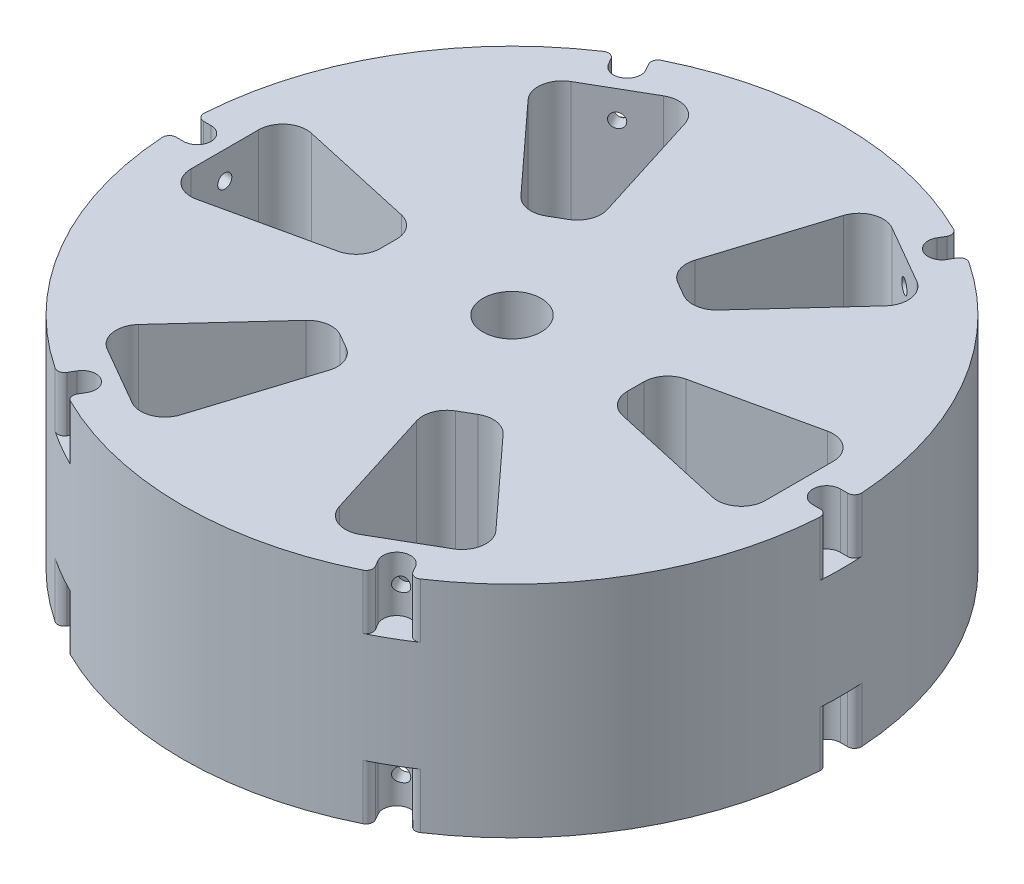
from build123d import *

# Parameters (mm, degrees)
SKETCH1_R                        = 76.2
SKETCH1_R_2                      = 15.875
BOSS_EXTRUDE1_DEPTH              = 25.4
CUT_EXTRUDE1_START               = -12.7
CUT_EXTRUDE1_DEPTH               = 12.7
CUT_EXTRUDE2_DEPTH               = 120.1365603
F_30_0_1285_DIAMETER_HOLE1_D     = 3.2639
F_30_0_1285_DIAMETER_HOLE1_DEPTH = 9.779
FILLET1_R                        = 1.5875
FILLET2_R                        = 5.55625
CIRPATTERN1_COUNT                = 6
CIRPATTERN1_START                = -12.7
CIRPATTERN1_COPY_1_DEPTH         = 12.7
CIRPATTERN1_COPY_2_DEPTH         = 12.7
CIRPATTERN1_COPY_3_DEPTH         = 12.7
CIRPATTERN1_COPY_4_DEPTH         = 12.7
CIRPATTERN1_COPY_5_DEPTH         = 12.7
CIRPATTERN1_COPY_6_D             = 3.2639
CIRPATTERN1_COPY_6_DEPTH         = 9.779
CIRPATTERN1_COPY_7_D             = 3.2639
CIRPATTERN1_COPY_7_DEPTH         = 9.779
CIRPATTERN1_COPY_8_D             = 3.2639
CIRPATTERN1_COPY_8_DEPTH         = 9.779
CIRPATTERN1_COPY_9_D             = 3.2639
CIRPATTERN1_COPY_9_DEPTH         = 9.779
CIRPATTERN1_COPY_10_D            = 3.2639
CIRPATTERN1_COPY_10_DEPTH        = 9.779
FILLET1_OF_CIRPATTERN1_R         = 1.5875
FILLET2_OF_CIRPATTERN1_R         = 5.55625
BOSS_EXTRUDE2_START              = -10.668
SKETCH7_R                        = 15.875
SKETCH7_R_2                      = 6.74624
BOSS_EXTRUDE2_DEPTH              = 10.668
FILLET3_R                        = 1.5875
SKETCH8_R                        = 25.4
CUT_EXTRUDE3_DEPTH               = 25.4


with BuildPart() as part:
    # Sketch1 → Boss-Extrude1 (new, symmetric)
    with BuildSketch(Plane(origin=(0, 0, 0), x_dir=(1, 0, 0), z_dir=(0, 1, 0))):
        with Locations(Location((0, 0, 0), (0, 0, 270))):
            Circle(SKETCH1_R)
        with Locations(Location((0, 0, 0), (0, 0, 270))):
            Circle(SKETCH1_R_2, mode=Mode.SUBTRACT)
    extrude(amount=BOSS_EXTRUDE1_DEPTH, both=True)

    # Sketch3 → Cut-Extrude1 (cut)
    with BuildSketch(Plane(origin=(0, -25.4, 0), x_dir=(-1, 0, 0), z_dir=(0, -1, 0)).offset(CUT_EXTRUDE1_START)):
        with BuildLine():
            Line((-76.133825433, 3.175), (-72.771, 3.175))
            ThreePointArc((-72.771, 3.175), (-69.596, 0), (-72.771, -3.175))
            Line((-72.771, -3.175), (-76.133825433, -3.175))
            ThreePointArc((-76.133825433, -3.175), (-76.2, 0), (-76.133825433, 3.175))
        make_face()
    cut_extrude1 = extrude(amount=CUT_EXTRUDE1_DEPTH, mode=Mode.SUBTRACT)

    # Sketch4 → Cut-Extrude2 (cut, through all)
    with BuildSketch(Plane(origin=(0, -25.4, 0), x_dir=(-1, 0, 0), z_dir=(0, -1, 0))):
        Polygon((-66.421, 14.760222222), (-66.421, -14.760222222), (-28.575, -6.35), (-28.575, 6.35), align=None)
    cut_extrude2 = extrude(amount=-CUT_EXTRUDE2_DEPTH, mode=Mode.SUBTRACT)

    # #30 (0.1285) Diameter Hole1
    with Locations(Plane.ZY.offset(-66.421)):
        with Locations((0, -19.05)):
            f_30_0_1285_diameter_hole1 = Hole(F_30_0_1285_DIAMETER_HOLE1_D / 2, depth=F_30_0_1285_DIAMETER_HOLE1_DEPTH)

    # Fillet1
    fillet1_edges = [part.edges().sort_by_distance(p)[0] for p in [
        (76.133825433, -19.05, 3.175),
        (76.133825433, -19.05, -3.175),
    ]]
    fillet(fillet1_edges, radius=FILLET1_R)

    # Fillet2
    fillet2_edges = [part.edges().sort_by_distance(p)[0] for p in [
        (66.421, 0, -14.760222222),
        (28.575, 0, -6.35),
        (28.575, 0, 6.35),
        (66.421, 0, 14.760222222),
    ]]
    fillet(fillet2_edges, radius=FILLET2_R)

    # Mirror1: Cut-Extrude1, #30 (0.1285) Diameter Hole1 across plane
    add(cut_extrude1.mirror(Plane.ZX), mode=Mode.SUBTRACT)
    add(f_30_0_1285_diameter_hole1.mirror(Plane.ZX), mode=Mode.SUBTRACT)

    # CirPattern1: Cut-Extrude1, Cut-Extrude2, #30 (0.1285) Diameter Hole1 ×6 about axis
    cirpattern1_axis = Axis((0, 0, 0), (0, 1, 0))
    add([cut_extrude1.rotate(cirpattern1_axis, i * 360 / CIRPATTERN1_COUNT) for i in range(1, CIRPATTERN1_COUNT)], mode=Mode.SUBTRACT)
    add([cut_extrude2.rotate(cirpattern1_axis, i * 360 / CIRPATTERN1_COUNT) for i in range(1, CIRPATTERN1_COUNT)], mode=Mode.SUBTRACT)
    add([f_30_0_1285_diameter_hole1.rotate(cirpattern1_axis, i * 360 / CIRPATTERN1_COUNT) for i in range(1, CIRPATTERN1_COUNT)], mode=Mode.SUBTRACT)

    # CirPattern1 copy 1 sketch → CirPattern1 copy 1 (cut)
    with BuildSketch(Plane(origin=(0, 25.4, 0), x_dir=(-0.5000000000000001, 0, 0.8660254037844386), z_dir=(0, 1, 0)).offset(CIRPATTERN1_START)):
        with BuildLine():
            Line((-76.133825433, -3.175), (-72.771, -3.175))
            ThreePointArc((-72.771, -3.175), (-69.596, 0), (-72.771, 3.175))
            Line((-72.771, 3.175), (-76.133825433, 3.175))
            ThreePointArc((-76.133825433, 3.175), (-76.2, 0), (-76.133825433, -3.175))
        make_face()
    extrude(amount=CIRPATTERN1_COPY_1_DEPTH, mode=Mode.SUBTRACT)

    # CirPattern1 copy 2 sketch → CirPattern1 copy 2 (cut)
    with BuildSketch(Plane(origin=(0, 25.4, 0), x_dir=(0.4999999999999998, 0, 0.8660254037844387), z_dir=(0, 1, 0)).offset(CIRPATTERN1_START)):
        with BuildLine():
            Line((-76.133825433, -3.175), (-72.771, -3.175))
            ThreePointArc((-72.771, -3.175), (-69.596, 0), (-72.771, 3.175))
            Line((-72.771, 3.175), (-76.133825433, 3.175))
            ThreePointArc((-76.133825433, 3.175), (-76.2, 0), (-76.133825433, -3.175))
        make_face()
    extrude(amount=CIRPATTERN1_COPY_2_DEPTH, mode=Mode.SUBTRACT)

    # CirPattern1 copy 3 sketch → CirPattern1 copy 3 (cut)
    with BuildSketch(Plane(origin=(0, 25.4, 0), x_dir=(1, 0, 0), z_dir=(0, 1, 0)).offset(CIRPATTERN1_START)):
        with BuildLine():
            Line((-76.133825433, -3.175), (-72.771, -3.175))
            ThreePointArc((-72.771, -3.175), (-69.596, 0), (-72.771, 3.175))
            Line((-72.771, 3.175), (-76.133825433, 3.175))
            ThreePointArc((-76.133825433, 3.175), (-76.2, 0), (-76.133825433, -3.175))
        make_face()
    extrude(amount=CIRPATTERN1_COPY_3_DEPTH, mode=Mode.SUBTRACT)

    # CirPattern1 copy 4 sketch → CirPattern1 copy 4 (cut)
    with BuildSketch(Plane(origin=(0, 25.4, 0), x_dir=(0.5000000000000004, 0, -0.8660254037844384), z_dir=(0, 1, 0)).offset(CIRPATTERN1_START)):
        with BuildLine():
            Line((-76.133825433, -3.175), (-72.771, -3.175))
            ThreePointArc((-72.771, -3.175), (-69.596, 0), (-72.771, 3.175))
            Line((-72.771, 3.175), (-76.133825433, 3.175))
            ThreePointArc((-76.133825433, 3.175), (-76.2, 0), (-76.133825433, -3.175))
        make_face()
    extrude(amount=CIRPATTERN1_COPY_4_DEPTH, mode=Mode.SUBTRACT)

    # CirPattern1 copy 5 sketch → CirPattern1 copy 5 (cut)
    with BuildSketch(Plane(origin=(0, 25.4, 0), x_dir=(-0.5000000000000001, 0, -0.8660254037844386), z_dir=(0, 1, 0)).offset(CIRPATTERN1_START)):
        with BuildLine():
            Line((-76.133825433, -3.175), (-72.771, -3.175))
            ThreePointArc((-72.771, -3.175), (-69.596, 0), (-72.771, 3.175))
            Line((-72.771, 3.175), (-76.133825433, 3.175))
            ThreePointArc((-76.133825433, 3.175), (-76.2, 0), (-76.133825433, -3.175))
        make_face()
    extrude(amount=CIRPATTERN1_COPY_5_DEPTH, mode=Mode.SUBTRACT)

    # CirPattern1 copy 6
    with Locations(Plane(origin=(33.2105, 0, -57.522273345), x_dir=(0.8660254037844386, 0, 0.5000000000000001), z_dir=(-0.5000000000000001, 0, 0.8660254037844386))):
        with Locations((0, 19.05)):
            Hole(CIRPATTERN1_COPY_6_D / 2, depth=CIRPATTERN1_COPY_6_DEPTH)

    # CirPattern1 copy 7
    with Locations(Plane(origin=(-33.2105, 0, -57.522273345), x_dir=(0.8660254037844387, 0, -0.4999999999999998), z_dir=(0.4999999999999998, 0, 0.8660254037844387))):
        with Locations((0, 19.05)):
            Hole(CIRPATTERN1_COPY_7_D / 2, depth=CIRPATTERN1_COPY_7_DEPTH)

    # CirPattern1 copy 8
    with Locations(Plane(origin=(-66.421, 0, 0), x_dir=(0, 0, -1), z_dir=(1, 0, 0))):
        with Locations((0, 19.05)):
            Hole(CIRPATTERN1_COPY_8_D / 2, depth=CIRPATTERN1_COPY_8_DEPTH)

    # CirPattern1 copy 9
    with Locations(Plane(origin=(-33.2105, 0, 57.522273345), x_dir=(-0.8660254037844384, 0, -0.5000000000000004), z_dir=(0.5000000000000004, 0, -0.8660254037844384))):
        with Locations((0, 19.05)):
            Hole(CIRPATTERN1_COPY_9_D / 2, depth=CIRPATTERN1_COPY_9_DEPTH)

    # CirPattern1 copy 10
    with Locations(Plane(origin=(33.2105, 0, 57.522273345), x_dir=(-0.8660254037844386, 0, 0.5000000000000001), z_dir=(-0.5000000000000001, 0, -0.8660254037844386))):
        with Locations((0, 19.05)):
            Hole(CIRPATTERN1_COPY_10_D / 2, depth=CIRPATTERN1_COPY_10_DEPTH)

    # Fillet1 of CirPattern1
    fillet1_of_cirpattern1_edges = [part.edges().sort_by_distance(p)[0] for p in [
        (40.816543373, -19.05, -64.346326912),
        (35.317282059, -19.05, -67.521326912),
        (-35.317282059, -19.05, -67.521326912),
        (-40.816543373, -19.05, -64.346326912),
        (-76.133825433, -19.05, -3.175),
        (-76.133825433, -19.05, 3.175),
        (-40.816543373, -19.05, 64.346326912),
        (-35.317282059, -19.05, 67.521326912),
        (35.317282059, -19.05, 67.521326912),
        (40.816543373, -19.05, 64.346326912),
    ]]
    fillet(fillet1_of_cirpattern1_edges, radius=FILLET1_OF_CIRPATTERN1_R)

    # Fillet2 of CirPattern1
    fillet2_of_cirpattern1_edges = [part.edges().sort_by_distance(p)[0] for p in [
        (20.42777259, 0, -64.902384456),
        (8.788238686, 0, -27.921675913),
        (19.786761314, 0, -21.571675913),
        (45.99322741, 0, -50.142162234),
        (-45.99322741, 0, -50.142162234),
        (-19.786761314, 0, -21.571675913),
        (-8.788238686, 0, -27.921675913),
        (-20.42777259, 0, -64.902384456),
        (-66.421, 0, 14.760222222),
        (-28.575, 0, 6.35),
        (-28.575, 0, -6.35),
        (-66.421, 0, -14.760222222),
        (-20.42777259, 0, 64.902384456),
        (-8.788238686, 0, 27.921675913),
        (-19.786761314, 0, 21.571675913),
        (-45.99322741, 0, 50.142162234),
        (45.99322741, 0, 50.142162234),
        (19.786761314, 0, 21.571675913),
        (8.788238686, 0, 27.921675913),
        (20.42777259, 0, 64.902384456),
    ]]
    fillet(fillet2_of_cirpattern1_edges, radius=FILLET2_OF_CIRPATTERN1_R)

    # Sketch7 → Boss-Extrude2 (add)
    with BuildSketch(Plane(origin=(0, 25.4, 0), x_dir=(1, 0, 0), z_dir=(0, 1, 0)).offset(BOSS_EXTRUDE2_START)):
        with Locations(Location((0, 0, 0), (0, 0, 270))):
            Circle(SKETCH7_R)
        with Locations(Location((0, 0, 0), (0, 0, 270))):
            Circle(SKETCH7_R_2, mode=Mode.SUBTRACT)
    extrude(amount=BOSS_EXTRUDE2_DEPTH)

    # Fillet3
    fillet3_edges = [part.edges().sort_by_distance(p)[0] for p in [
        (35.317282059, 19.05, -67.521326912),
        (40.816543373, 19.05, -64.346326912),
        (-40.816543373, 19.05, -64.346326912),
        (-35.317282059, 19.05, -67.521326912),
        (-76.133825433, 19.05, 3.175),
        (-76.133825433, 19.05, -3.175),
        (-35.317282059, 19.05, 67.521326912),
        (-40.816543373, 19.05, 64.346326912),
        (40.816543373, 19.05, 64.346326912),
        (35.317282059, 19.05, 67.521326912),
        (76.133825433, 19.05, -3.175),
        (76.133825433, 19.05, 3.175),
    ]]
    fillet(fillet3_edges, radius=FILLET3_R)

    # Sketch8 → Cut-Extrude3 (cut)
    with BuildSketch(Plane.XZ.offset(25.4)):
        with Locations(Location((0, 0, 0), (0, 0, 270))):
            Circle(SKETCH8_R)
    extrude(amount=-CUT_EXTRUDE3_DEPTH, mode=Mode.SUBTRACT)


solid = part.part
